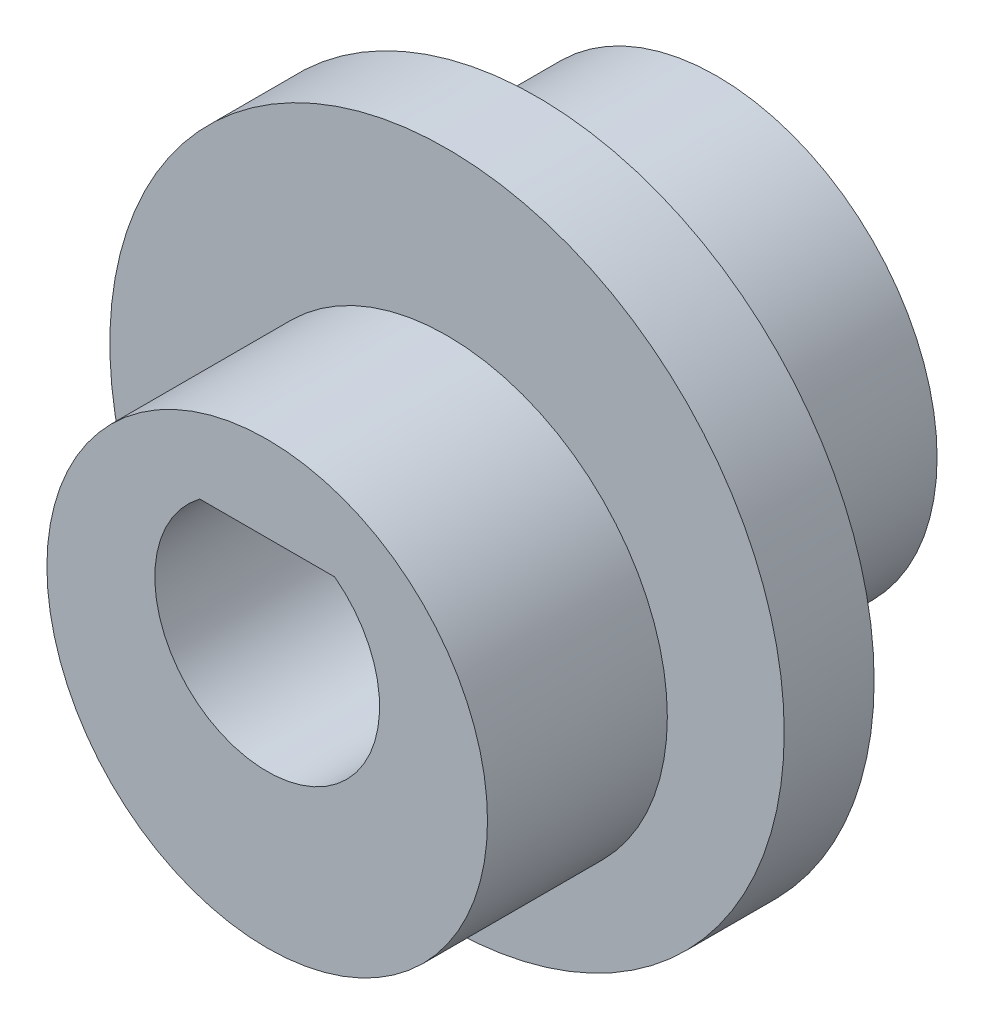
from build123d import *

# Parameters (mm, degrees)
ESQUISSE1_R             = 4.9
BOSS_EXTRU_1_DEPTH      = 4
ESQUISSE4_R             = 7.5
BOSS_EXTRU_4_DEPTH      = 2
ESQUISSE5_R             = 4.9
BOSS_EXTRU_5_DEPTH      = 4
ENL_V_MAT_EXTRU_1_DEPTH = 15.577379737


with BuildPart() as part:
    # Esquisse1 → Boss.-Extru.1 (new body)
    with BuildSketch(Plane.XY):
        with Locations((0, 1)):
            Circle(ESQUISSE1_R)
    extrude(amount=BOSS_EXTRU_1_DEPTH)

    # Esquisse4 → Boss.-Extru.4 (add)
    with BuildSketch(Plane.XY.offset(4)):
        Circle(ESQUISSE4_R)
    extrude(amount=BOSS_EXTRU_4_DEPTH)

    # Esquisse5 → Boss.-Extru.5 (add)
    with BuildSketch(Plane.XY.offset(6)):
        with Locations((0, -1)):
            Circle(ESQUISSE5_R)
    extrude(amount=BOSS_EXTRU_5_DEPTH)

    # Esquisse6 → Enlèv. mat.-Extru.1 (cut, through all)
    with BuildSketch(Plane.XY.offset(10)):
        with BuildLine():
            Line((-1.5, 2), (1.5, 2))
            ThreePointArc((1.5, 2), (0, -2.5), (-1.5, 2))
        make_face()
    extrude(amount=-ENL_V_MAT_EXTRU_1_DEPTH, mode=Mode.SUBTRACT)


solid = part.part
